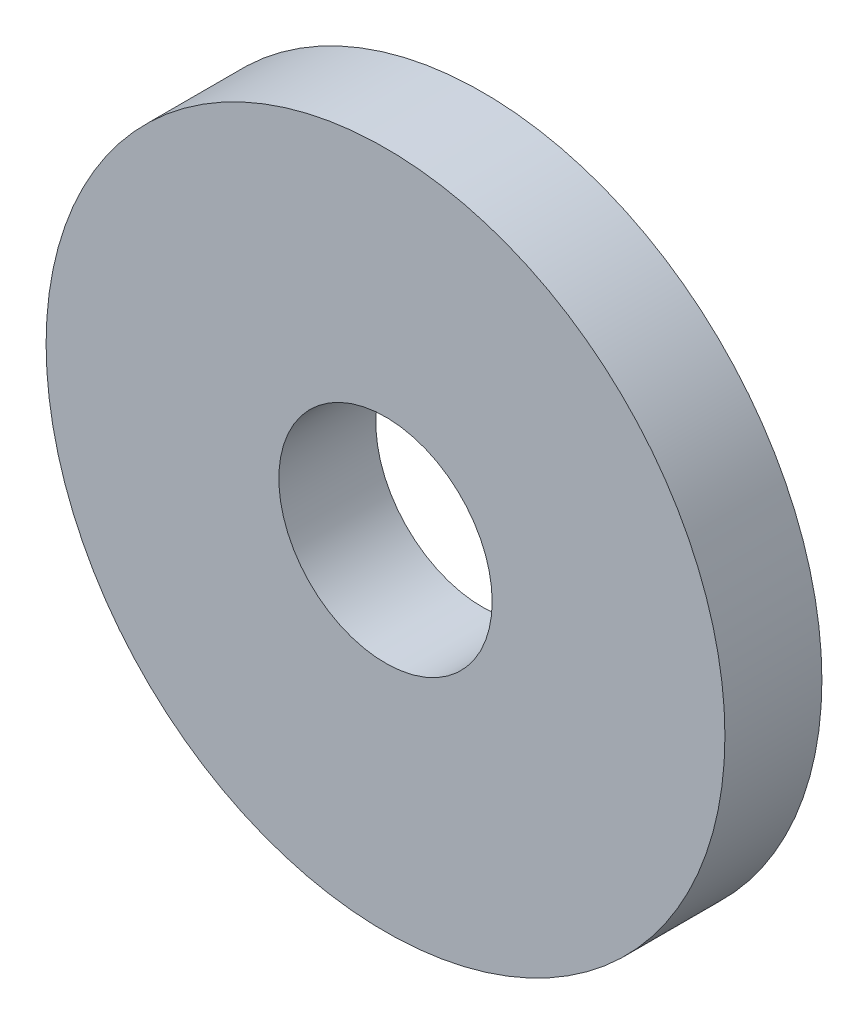
from build123d import *

# Parameters (mm, degrees)
SKETCH1_R           = 3.5
SKETCH1_R_2         = 1.1
BOSS_EXTRUDE1_DEPTH = 1


with BuildPart() as part:
    # Sketch1 → Boss-Extrude1 (new body)
    with BuildSketch(Plane.XY):
        Circle(SKETCH1_R)
        Circle(SKETCH1_R_2, mode=Mode.SUBTRACT)
    extrude(amount=BOSS_EXTRUDE1_DEPTH)


solid = part.part
